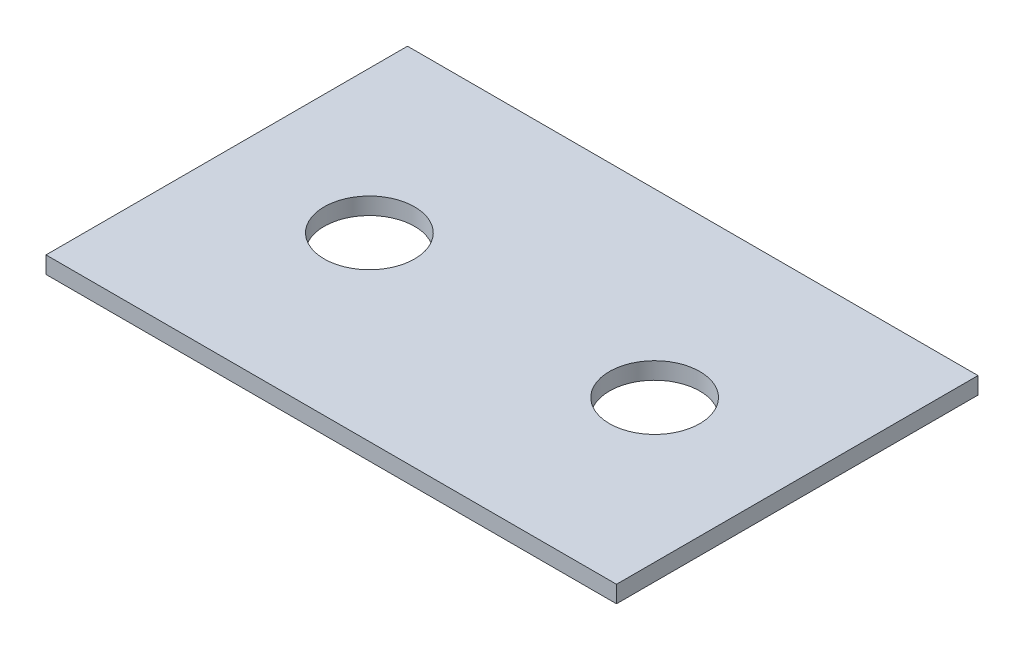
from build123d import *

# Parameters (mm, degrees)
SKETCH1_W           = 101
SKETCH1_H           = 64
SKETCH1_R           = 8
BOSS_EXTRUDE1_DEPTH = 3


with BuildPart() as part:
    # Sketch1 → Boss-Extrude1 (new body)
    with BuildSketch(Plane(origin=(0, 0, 0), x_dir=(1, 0, 0), z_dir=(0, 1, 0))):
        Rectangle(SKETCH1_W, SKETCH1_H)
        with Locations(Location((-25.25, 0, 0), (0, 0, 270))):
            Circle(SKETCH1_R, mode=Mode.SUBTRACT)
        with Locations(Location((25.25, 0, 0), (0, 0, 270))):
            Circle(SKETCH1_R, mode=Mode.SUBTRACT)
    extrude(amount=BOSS_EXTRUDE1_DEPTH)


solid = part.part
